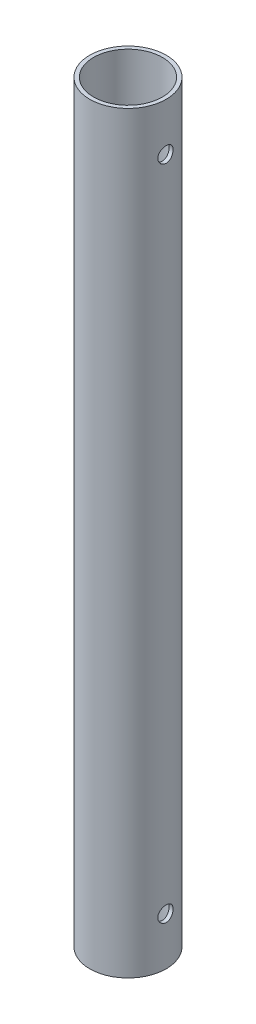
from build123d import *

# Parameters (mm, degrees)
SKETCH1_R           = 10
SKETCH1_R_2         = 9
BOSS_EXTRUDE1_DEPTH = 197
SKETCH2_R           = 2
CUT_EXTRUDE1_DEPTH  = 199.264974214


with BuildPart() as part:
    # Sketch1 → Boss-Extrude1 (new body)
    with BuildSketch(Plane(origin=(0, 0, 0), x_dir=(1, 0, 0), z_dir=(0, 1, 0))):
        Circle(SKETCH1_R)
        Circle(SKETCH1_R_2, mode=Mode.SUBTRACT)
    extrude(amount=BOSS_EXTRUDE1_DEPTH)

    # Sketch2 → Cut-Extrude1 (cut, through all)
    with BuildSketch(Plane(origin=(10, 0, 0), x_dir=(0, 0, -1), z_dir=(1, 0, 0))):
        with Locations((0, 184.5)):
            Circle(SKETCH2_R)
        with Locations((0, 12.5)):
            Circle(SKETCH2_R)
    extrude(amount=-CUT_EXTRUDE1_DEPTH, mode=Mode.SUBTRACT)


solid = part.part
